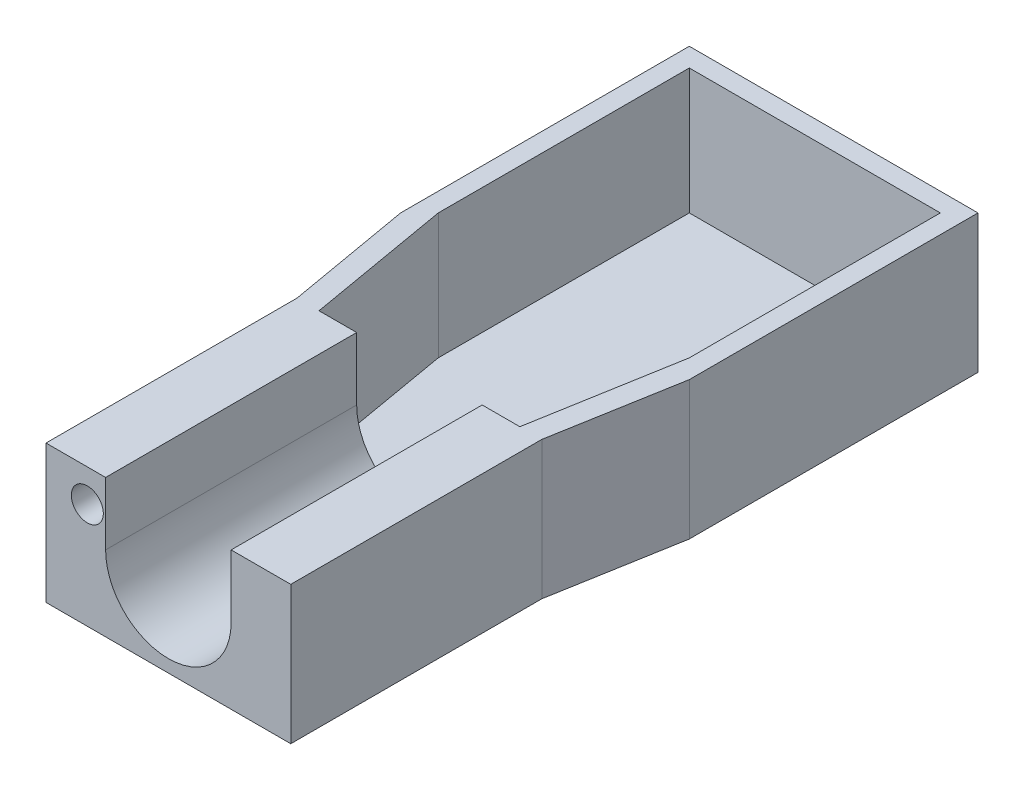
from build123d import *

# Parameters (mm, degrees)
SKETCH1_W           = 46
SKETCH1_H           = 46
SKETCH1_W_2         = 40
SKETCH1_H_2         = 40
BOSS_EXTRUDE1_DEPTH = 20
SKETCH2_W           = 46
SKETCH2_H           = 46
BOSS_EXTRUDE2_DEPTH = 2
BOSS_EXTRUDE3_DEPTH = 22
CUT_EXTRUDE1_DEPTH  = 20
BOSS_EXTRUDE5_DEPTH = 2
BOSS_EXTRUDE6_DEPTH = 40
SKETCH8_R           = 2.55
CUT_EXTRUDE2_DEPTH  = 60
SKETCH9_W           = 1
SKETCH9_H           = 20
BOSS_EXTRUDE7_DEPTH = 40


with BuildPart() as part:
    # Sketch1 → Boss-Extrude1 (new body)
    with BuildSketch(Plane(origin=(0, 0, 0), x_dir=(1, 0, 0), z_dir=(0, 1, 0))):
        Rectangle(SKETCH1_W, SKETCH1_H)
        Rectangle(SKETCH1_W_2, SKETCH1_H_2, mode=Mode.SUBTRACT)
    extrude(amount=BOSS_EXTRUDE1_DEPTH)

    # Sketch2 → Boss-Extrude2 (add)
    with BuildSketch(Plane.XZ):
        Rectangle(SKETCH2_W, SKETCH2_H)
    extrude(amount=BOSS_EXTRUDE2_DEPTH)

    # Sketch3 → Boss-Extrude3 (add)
    with BuildSketch(Plane(origin=(0, 20, 0), x_dir=(1, 0, 0), z_dir=(0, 1, 0))):
        Polygon((-16, -43), (-19.47826087, -23), (-23, -23), (-19.5, -43), align=None)
        Polygon((23, -23), (19.47826087, -23), (16, -43), (19.5, -43), align=None)
    extrude(amount=-BOSS_EXTRUDE3_DEPTH)

    # Sketch3<3> → Cut-Extrude1 (cut)
    with BuildSketch(Plane(origin=(0, 20, 0), x_dir=(1, 0, 0), z_dir=(0, 1, 0))):
        Polygon((20, -20), (-20, -20), (-19.47826087, -23), (19.47826087, -23), align=None)
    extrude(amount=-CUT_EXTRUDE1_DEPTH, mode=Mode.SUBTRACT)

    # Sketch5 → Boss-Extrude5 (add)
    with BuildSketch(Plane.XZ.offset(2)):
        Polygon((-16, 43), (-19.47826087, 23), (19.47826087, 23), (16, 43), align=None)
    extrude(amount=-BOSS_EXTRUDE5_DEPTH)

    # Sketch6 → Boss-Extrude6 (add)
    with BuildSketch(Plane.XY.offset(43)):
        with BuildLine():
            Line((-10, 20), (-15, 20))
            Line((-15, 20), (-15, 0))
            Line((-15, 0), (-16, 0))
            Line((-16, 0), (-16, 20))
            Line((-16, 20), (-19.5, 20))
            Line((-19.5, 20), (-19.5, -2))
            Line((-19.5, -2), (19.5, -2))
            Line((19.5, -2), (19.5, 20))
            Line((19.5, 20), (16, 20))
            Line((16, 20), (16, 0))
            Line((16, 0), (15, 0))
            Line((15, 0), (15, 20))
            Line((15, 20), (10, 20))
            Line((10, 20), (10, 10))
            ThreePointArc((10, 10), (0, 0), (-10, 10))
            Line((-10, 10), (-10, 20))
        make_face()
    extrude(amount=BOSS_EXTRUDE6_DEPTH)

    # Sketch8 → Cut-Extrude2 (cut)
    with BuildSketch(Plane.XY.offset(83)):
        with Locations((-12.914377538, 14.827782421)):
            Circle(SKETCH8_R)
    extrude(amount=-CUT_EXTRUDE2_DEPTH, mode=Mode.SUBTRACT)

    # Sketch9 → Boss-Extrude7 (add)
    with BuildSketch(Plane.XY.offset(83)):
        with Locations((15.5, 10)):
            Rectangle(SKETCH9_W, SKETCH9_H)
        with BuildLine():
            Line((-15, 16.294983479), (-15, 20))
            Line((-15, 20), (-16, 20))
            Line((-16, 20), (-16, 0))
            Line((-16, 0), (-15, 0))
            Line((-15, 0), (-15, 13.360581363))
            ThreePointArc((-15, 13.360581363), (-15.464377538, 14.827782421), (-15, 16.294983479))
        make_face()
    extrude(amount=-BOSS_EXTRUDE7_DEPTH)


solid = part.part
